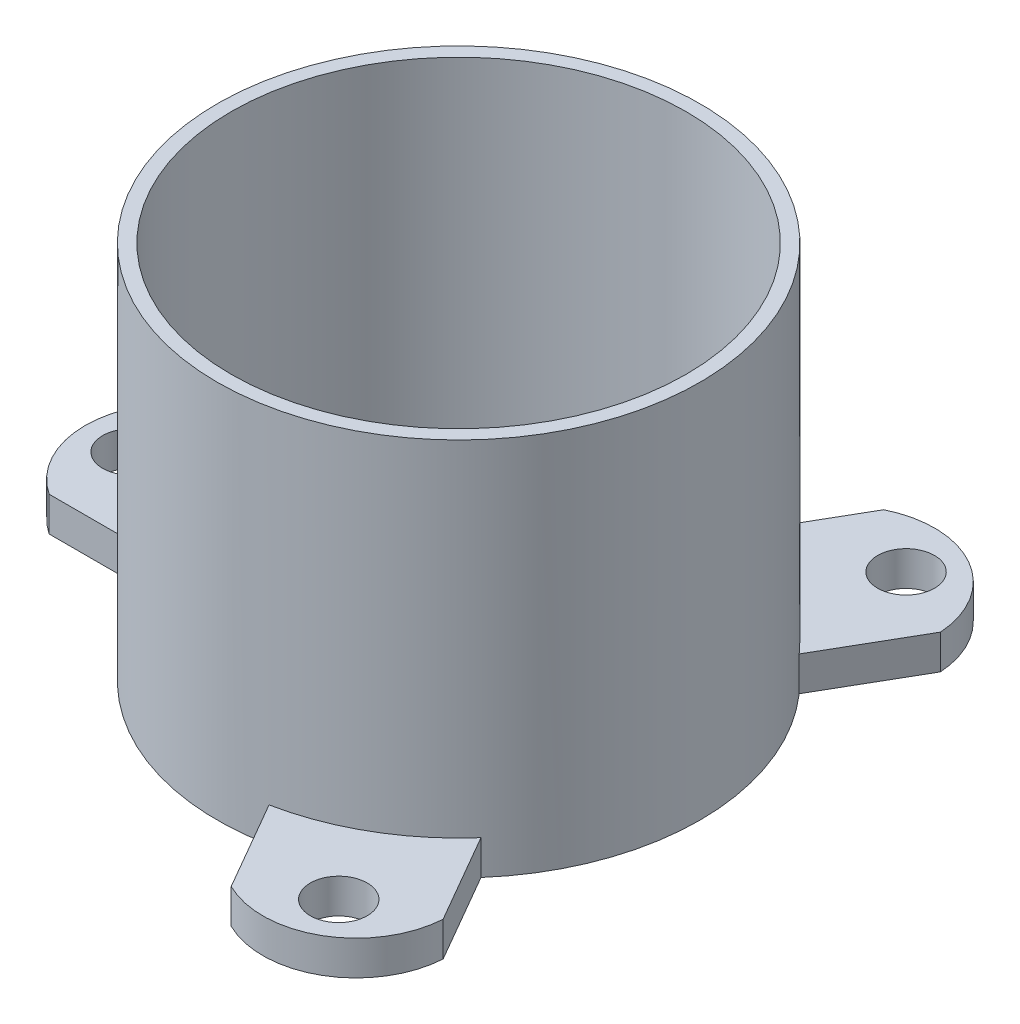
from build123d import *

# Parameters (mm, degrees)
ESBO_O4_R                = 1.65
RESSALTO_EXTRUS_O2_DEPTH = 2
ESBO_O5_R                = 14
RESSALTO_EXTRUS_O3_DEPTH = 20
ESBO_O6_R                = 13.2
CORTE_EXTRUS_O1_DEPTH    = 20


with BuildPart() as part:
    # Esboço4 → Ressalto-extrusão2 (new body)
    with BuildSketch(Plane(origin=(0, 0, 0), x_dir=(1, 0, 0), z_dir=(0, 1, 0))):
        with BuildLine():
            Line((-19.257073584, -4.5), (-13.257073584, -4.5))
            ThreePointArc((-13.257073584, -4.5), (-7, -12.124355653), (2.731422475, -13.730962503))
            Line((2.731422475, -13.730962503), (5.731422475, -18.927114926))
            ThreePointArc((5.731422475, -18.927114926), (10.832700248, -18.762787213), (13.525651109, -14.427114926))
            Line((13.525651109, -14.427114926), (10.525651109, -9.230962503))
            ThreePointArc((10.525651109, -9.230962503), (14, 0), (10.525651109, 9.230962503))
            Line((10.525651109, 9.230962503), (13.525651109, 14.427114926))
            ThreePointArc((13.525651109, 14.427114926), (10.832700248, 18.762787213), (5.731422475, 18.927114926))
            Line((5.731422475, 18.927114926), (2.731422475, 13.730962503))
            ThreePointArc((2.731422475, 13.730962503), (-7, 12.124355653), (-13.257073584, 4.5))
            Line((-13.257073584, 4.5), (-19.257073584, 4.5))
            ThreePointArc((-19.257073584, 4.5), (-21.665400497, 0), (-19.257073584, -4.5))
        make_face()
        with Locations(Location((-19, 0, 0), (0, 0, 270))):
            Circle(ESBO_O4_R, mode=Mode.SUBTRACT)
        with Locations(Location((9.5, 16.454482672, 0), (0, 0, 270))):
            Circle(ESBO_O4_R, mode=Mode.SUBTRACT)
        with Locations(Location((9.5, -16.454482672, 0), (0, 0, 270))):
            Circle(ESBO_O4_R, mode=Mode.SUBTRACT)
    extrude(amount=RESSALTO_EXTRUS_O2_DEPTH)

    # Esboço5 → Ressalto-extrusão3 (add)
    with BuildSketch(Plane(origin=(0, 2, 0), x_dir=(1, 0, 0), z_dir=(0, 1, 0))):
        with Locations(Location((0, 0, 0), (0, 0, 78.749340847))):
            Circle(ESBO_O5_R)
    extrude(amount=RESSALTO_EXTRUS_O3_DEPTH)

    # Esboço6 → Corte-extrusão1 (cut)
    with BuildSketch(Plane(origin=(0, 22, 0), x_dir=(1, 0, 0), z_dir=(0, 1, 0))):
        with Locations(Location((0, 0, 0), (0, 0, 270))):
            Circle(ESBO_O6_R)
    extrude(amount=-CORTE_EXTRUS_O1_DEPTH, mode=Mode.SUBTRACT)


solid = part.part
